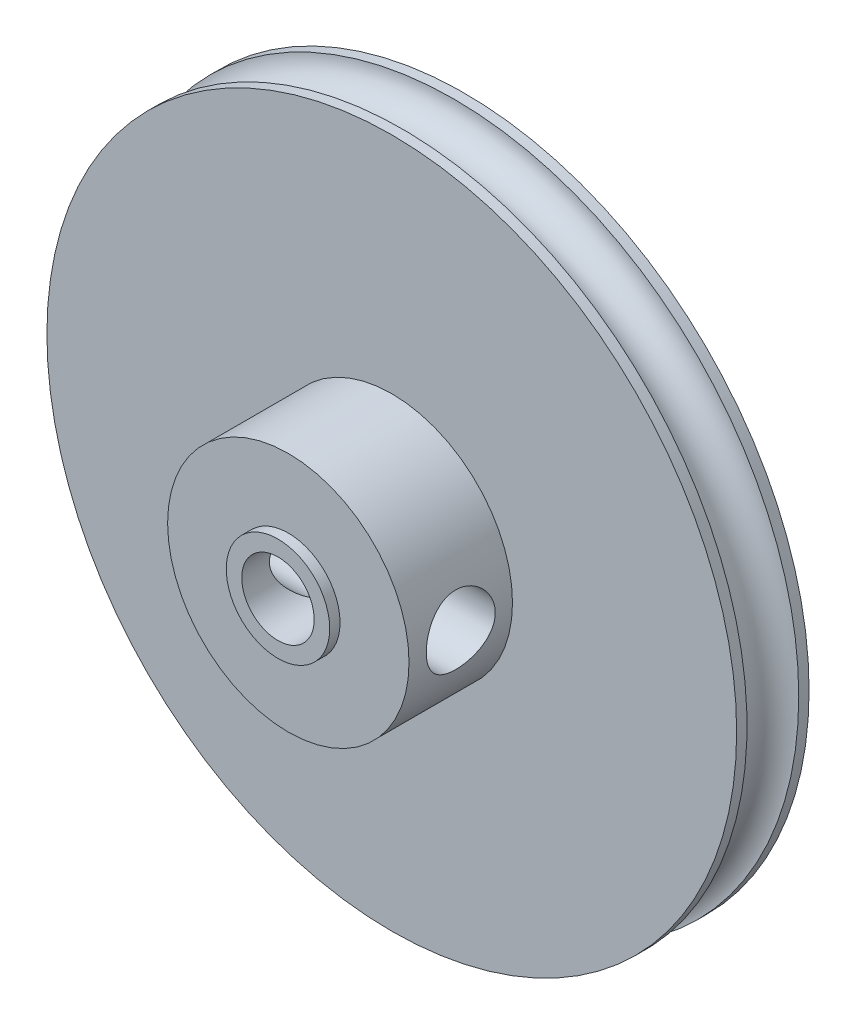
from build123d import *

# Parameters (mm, degrees)
ESQUISSE1_R                  = 20
ESQUISSE1_R_2                = 2.1
BOSS_EXTRU_1_DEPTH           = 4.2
ESQUISSE2_R                  = 7
ESQUISSE2_R_2                = 2.1
BOSS_EXTRU_2_DEPTH           = 6
ESQUISSE3_R                  = 1.5
ENL_V_MAT_EXTRU_1_DEPTH      = 31.067257939
ENL_V_MAT_EXTRU_1_DEPTH_BACK = 31.067257939
ESQUISSE5_R                  = 2
ESQUISSE7_R                  = 3
ESQUISSE7_R_2                = 2.1
BOSS_EXTRU_4_DEPTH           = 0.6
BOSS_EXTRU_5_START           = 0.5
ESQUISSE8_R                  = 3
ESQUISSE8_R_2                = 2.1
BOSS_EXTRU_5_DEPTH           = 0.5


with BuildPart() as part:
    # Esquisse1 → Boss.-Extru.1 (new body)
    with BuildSketch(Plane.XY):
        Circle(ESQUISSE1_R)
        Circle(ESQUISSE1_R_2, mode=Mode.SUBTRACT)
    extrude(amount=BOSS_EXTRU_1_DEPTH)

    # Esquisse2 → Boss.-Extru.2 (add)
    with BuildSketch(Plane.XY.offset(4.2)):
        Circle(ESQUISSE2_R)
        Circle(ESQUISSE2_R_2, mode=Mode.SUBTRACT)
    extrude(amount=BOSS_EXTRU_2_DEPTH)

    # Esquisse3 → Enlèvement de matière-Révolution1 (revolve, cut)
    with BuildSketch(Plane(origin=(0, 0, 0), x_dir=(0, 0, -1), z_dir=(1, 0, 0)), mode=Mode.PRIVATE) as enl_vement_de_mati_re_r_volution1_sk:
        with Locations((-2.1, 20)):
            Circle(ESQUISSE3_R)
    revolve(enl_vement_de_mati_re_r_volution1_sk.sketch.rotate(Axis((0, 0, 0), (0, 0, 1)), 90), axis=Axis((0, 0, 0), (0, 0, 1)), mode=Mode.SUBTRACT)

    # Esquisse5 → Enlèv. mat.-Extru.1 (cut, two sides: drawn at the far end of the back side and taken through both)
    with BuildSketch(Plane(origin=(0, 0, 0), x_dir=(0, 0, -1), z_dir=(1, 0, 0)).offset(-ENL_V_MAT_EXTRU_1_DEPTH_BACK)):
        with Locations((-7.2, 0)):
            Circle(ESQUISSE5_R)
    extrude(amount=ENL_V_MAT_EXTRU_1_DEPTH + ENL_V_MAT_EXTRU_1_DEPTH_BACK, mode=Mode.SUBTRACT)

    # Esquisse7 → Boss.-Extru.4 (add)
    with BuildSketch(Plane.XY.offset(10.2)):
        Circle(ESQUISSE7_R)
        Circle(ESQUISSE7_R_2, mode=Mode.SUBTRACT)
    extrude(amount=BOSS_EXTRU_4_DEPTH)

    # Esquisse8 → Boss.-Extru.5 (add)
    with BuildSketch(Plane(origin=(0, 0, 0), x_dir=(-1, 0, 0), z_dir=(0, 0, -1)).offset(BOSS_EXTRU_5_START)):
        with Locations(Location((0, 0, 0), (0, 0, 180))):
            Circle(ESQUISSE8_R)
        Circle(ESQUISSE8_R_2, mode=Mode.SUBTRACT)
    extrude(amount=-BOSS_EXTRU_5_DEPTH)


solid = part.part
